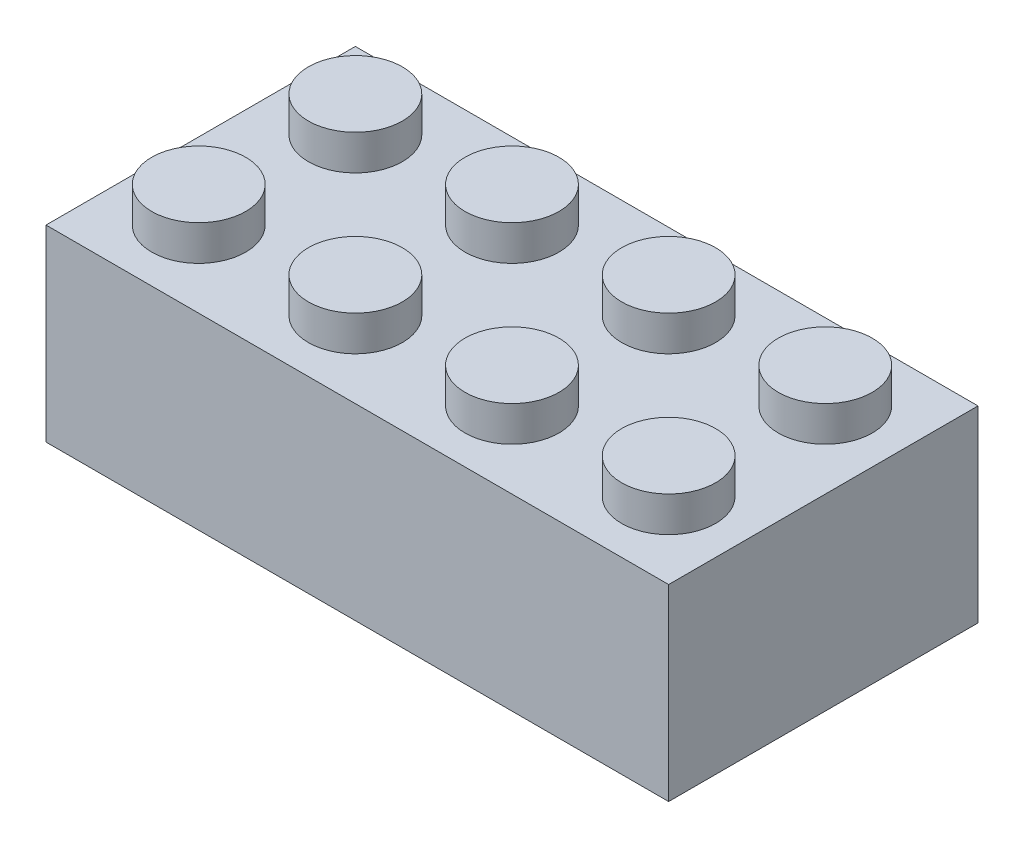
from build123d import *

# Parameters (mm, degrees)
SKETCH1_W           = 31.8
SKETCH1_H           = 15.8
BOSS_EXTRUDE1_DEPTH = 9.6
SKETCH2_R           = 2.4
BOSS_EXTRUDE2_DEPTH = 1.8
SKETCH1_5_R         = 3.25
SKETCH1_5_R_2       = 2.05
CUT_EXTRUDE3_DEPTH  = 8.6
SKETCH1_6_R         = 1.3
CUT_EXTRUDE4_DEPTH  = 10.3
SKETCH3_W           = 1.1
SKETCH3_H           = 3.496876524
BOSS_EXTRUDE3_DEPTH = 6.3
LPATTERN2_COUNT     = 3
LPATTERN2_PITCH     = 8


with BuildPart() as part:
    # Sketch1 → Boss-Extrude1 (new body)
    with BuildSketch(Plane(origin=(0, 0, 0), x_dir=(1, 0, 0), z_dir=(0, 1, 0))):
        Rectangle(SKETCH1_W, SKETCH1_H)
    extrude(amount=BOSS_EXTRUDE1_DEPTH)

    # Sketch2 → Boss-Extrude2 (add)
    with BuildSketch(Plane(origin=(0, 9.6, 0), x_dir=(1, 0, 0), z_dir=(0, 1, 0))):
        with Locations(Location((-12, 4, 0), (0, 0, 270))):
            Circle(SKETCH2_R)
        with Locations(Location((-4, 4, 0), (0, 0, 270))):
            Circle(SKETCH2_R)
        with Locations(Location((4, 4, 0), (0, 0, 270))):
            Circle(SKETCH2_R)
        with Locations(Location((12, 4, 0), (0, 0, 270))):
            Circle(SKETCH2_R)
        with Locations(Location((-4, -4, 0), (0, 0, 270))):
            Circle(SKETCH2_R)
        with Locations(Location((4, -4, 0), (0, 0, 270))):
            Circle(SKETCH2_R)
        with Locations(Location((12, -4, 0), (0, 0, 270))):
            Circle(SKETCH2_R)
        with Locations(Location((-12, -4, 0), (0, 0, 270))):
            Circle(SKETCH2_R)
    extrude(amount=BOSS_EXTRUDE2_DEPTH)

    # Sketch1<5> → Cut-Extrude3 (cut)
    # profile 1 of 4: a face of its own
    with BuildSketch(Plane(origin=(0, 0, 0), x_dir=(1, 0, 0), z_dir=(0, 1, 0))):
        Polygon((-14.7, 6.7), (-12.6, 6.7), (-12.6, 6.5), (-11.4, 6.5), (-11.4, 6.7), (-8, 6.7), (-4.6, 6.7), (-4.6, 6.5), (-3.4, 6.5), (-3.4, 6.7), (3.4, 6.7), (3.4, 6.5), (4.6, 6.5), (4.6, 6.7), (11.4, 6.7), (11.4, 6.5), (12.6, 6.5), (12.6, 6.7), (14.7, 6.7), (14.7, 4.6), (14.5, 4.6), (14.5, 3.4), (14.7, 3.4), (14.7, -3.4), (14.5, -3.4), (14.5, -4.6), (14.7, -4.6), (14.7, -6.7), (12.6, -6.7), (12.6, -6.5), (11.4, -6.5), (11.4, -6.7), (4.6, -6.7), (4.6, -6.5), (3.4, -6.5), (3.4, -6.7), (-3.4, -6.7), (-3.4, -6.5), (-4.6, -6.5), (-4.6, -6.7), (-8, -6.7), (-11.4, -6.7), (-11.4, -6.5), (-12.6, -6.5), (-12.6, -6.7), (-14.7, -6.7), (-14.7, -4.6), (-14.5, -4.6), (-14.5, -3.4), (-14.7, -3.4), (-14.7, 3.4), (-14.5, 3.4), (-14.5, 4.6), (-14.7, 4.6), align=None)
        with Locations(Location((-8, 0, 0), (0, 0, 90))):
            Circle(SKETCH1_5_R, mode=Mode.SUBTRACT)
        with Locations(Location((0, 0, 0), (0, 0, 90))):
            Circle(SKETCH1_5_R, mode=Mode.SUBTRACT)
        with Locations(Location((8, 0, 0), (0, 0, 90))):
            Circle(SKETCH1_5_R, mode=Mode.SUBTRACT)
    # profile 2 of 4: a face of its own
    with BuildSketch(Plane(origin=(0, 0, 0), x_dir=(1, 0, 0), z_dir=(0, 1, 0))):
        with Locations(Location((8, 0, 0), (0, 0, 90))):
            Circle(SKETCH1_5_R_2)
    # profile 3 of 4: a face of its own
    with BuildSketch(Plane(origin=(0, 0, 0), x_dir=(1, 0, 0), z_dir=(0, 1, 0))):
        with Locations(Location((0, 0, 0), (0, 0, 90))):
            Circle(SKETCH1_5_R_2)
    # profile 4 of 4: a face of its own
    with BuildSketch(Plane(origin=(0, 0, 0), x_dir=(1, 0, 0), z_dir=(0, 1, 0))):
        with Locations(Location((-8, 0, 0), (0, 0, 90))):
            Circle(SKETCH1_5_R_2)
    extrude(amount=CUT_EXTRUDE3_DEPTH, mode=Mode.SUBTRACT)

    # Sketch1<6> → Cut-Extrude4 (cut)
    with BuildSketch(Plane(origin=(0, 0, 0), x_dir=(1, 0, 0), z_dir=(0, 1, 0))):
        with Locations(Location((-12, -4, 0), (0, 0, 270))):
            Circle(SKETCH1_6_R)
        with Locations(Location((-12, 4, 0), (0, 0, 270))):
            Circle(SKETCH1_6_R)
        with Locations(Location((12, -4, 0), (0, 0, 270))):
            Circle(SKETCH1_6_R)
        with Locations(Location((12, 4, 0), (0, 0, 270))):
            Circle(SKETCH1_6_R)
    cut_extrude4 = extrude(amount=CUT_EXTRUDE4_DEPTH, mode=Mode.SUBTRACT)

    # Sketch3 → Boss-Extrude3 (add)
    with BuildSketch(Plane.XZ.offset(-8.6)):
        with Locations((0, 4.951561738)):
            Rectangle(SKETCH3_W, SKETCH3_H)
    boss_extrude3 = extrude(amount=BOSS_EXTRUDE3_DEPTH)

    # LPattern2: Cut-Extrude4 ×3
    with Locations(*[(i * LPATTERN2_PITCH, 0, 0) for i in range(1, LPATTERN2_COUNT)]):
        add(cut_extrude4, mode=Mode.SUBTRACT)

    # Mirror1: Boss-Extrude3 across plane
    add(boss_extrude3.mirror(Plane.XY))


solid = part.part
